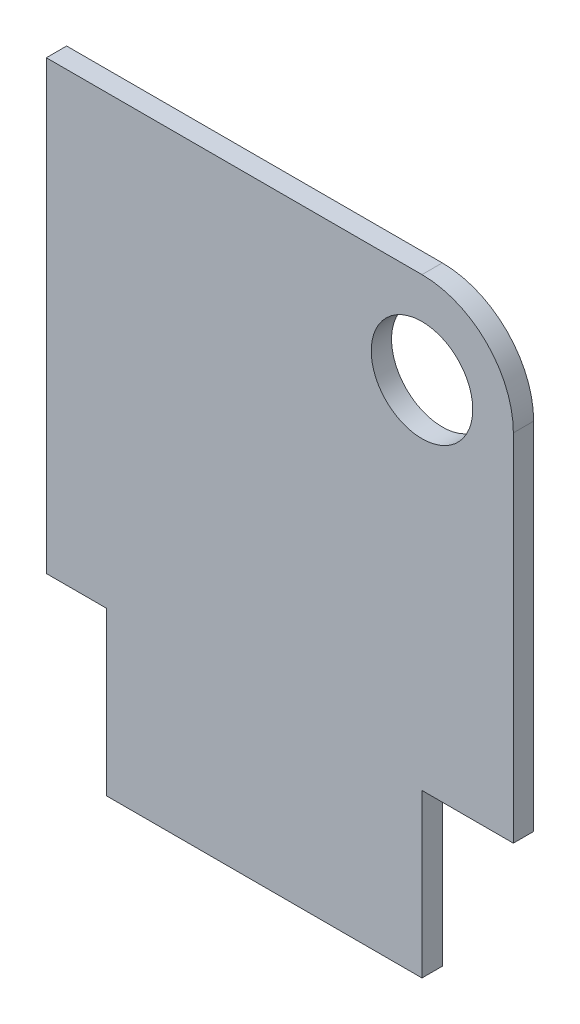
from build123d import *

# Parameters (mm, degrees)
ESQUISSE1_R        = 25
BOSS_EXTRU_1_DEPTH = 10


with BuildPart() as part:
    # Esquisse1 → Boss.-Extru.1 (new body)
    with BuildSketch(Plane.XY):
        with BuildLine():
            Line((0, 80), (0, 255))
            ThreePointArc((0, 255), (-13.180194847, 286.819805153), (-45, 300))
            Line((-45, 300), (-230, 300))
            Line((-230, 300), (-230, 80))
            Line((-230, 80), (-200.352260949, 80))
            Line((-200.352260949, 80), (-200.352260949, 0))
            Line((-200.352260949, 0), (-45, 0))
            Line((-45, 0), (-45, 80))
            Line((-45, 80), (0, 80))
        make_face()
        with Locations((-45, 255)):
            Circle(ESQUISSE1_R, mode=Mode.SUBTRACT)
    extrude(amount=BOSS_EXTRU_1_DEPTH)


solid = part.part
